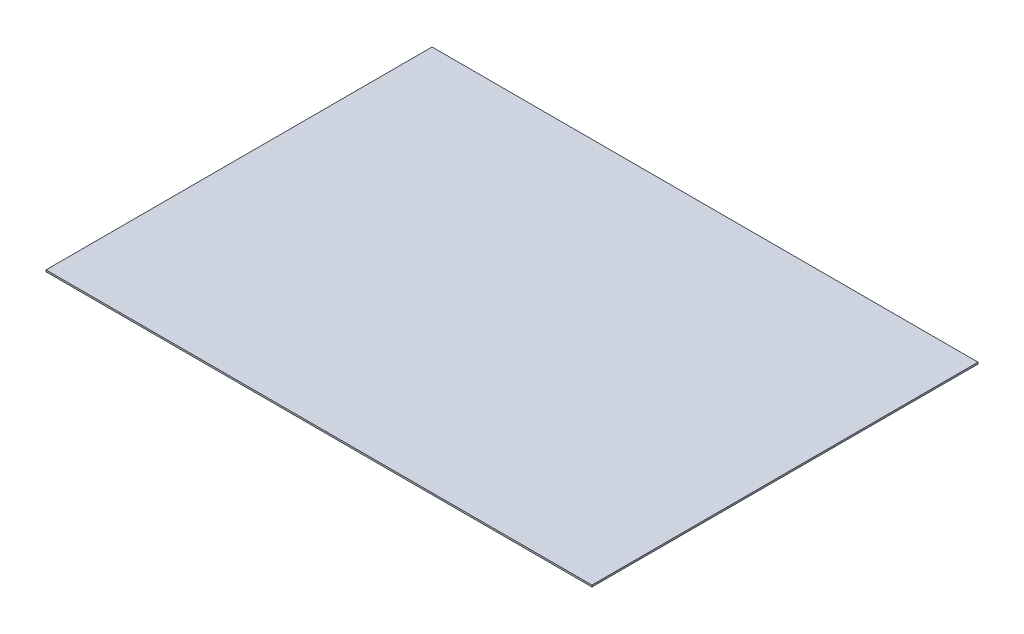
from build123d import *

# Parameters (mm, degrees)
SKETCH1_W           = 420
SKETCH1_H           = 297
BOSS_EXTRUDE1_DEPTH = 1.3


with BuildPart() as part:
    # Sketch1 → Boss-Extrude1 (new body)
    with BuildSketch(Plane(origin=(0, 0, 0), x_dir=(1, 0, 0), z_dir=(0, 1, 0))):
        Rectangle(SKETCH1_W, SKETCH1_H)
    extrude(amount=BOSS_EXTRUDE1_DEPTH)


solid = part.part
